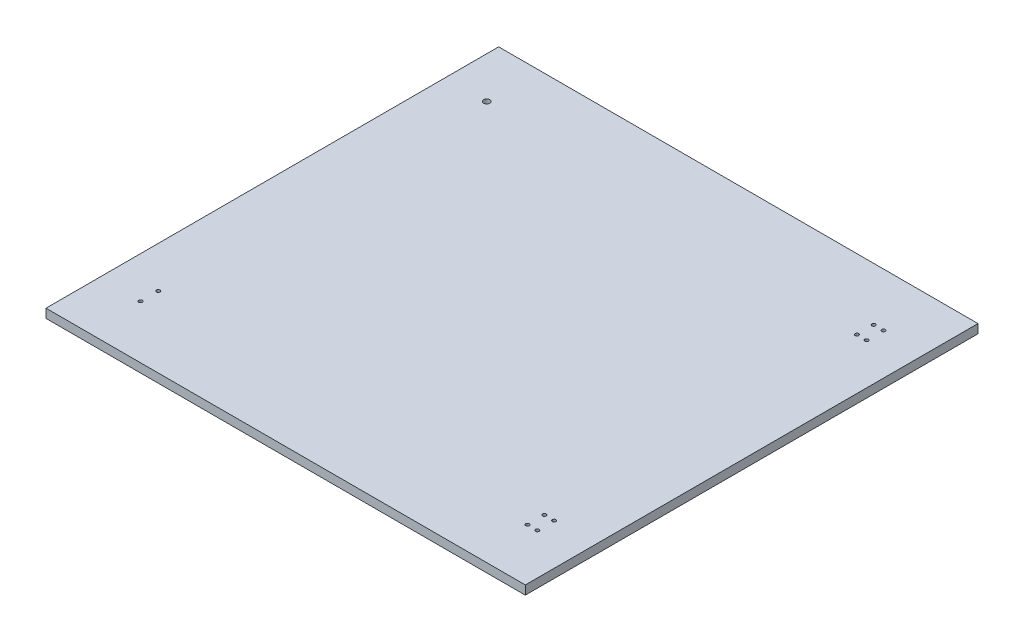
from build123d import *

# Parameters (mm, degrees)
SKETCH3_W           = 540
SKETCH3_H           = 510
BOSS_EXTRUDE1_DEPTH = 10
SKETCH4_R           = 2
CUT_EXTRUDE1_DEPTH  = 686.449855216
SKETCH6_R           = 2
CUT_EXTRUDE2_DEPTH  = 686.449855216
SKETCH7_R           = 3.5
CUT_EXTRUDE3_DEPTH  = 686.449855216
SKETCH8_R           = 2
CUT_EXTRUDE4_DEPTH  = 686.449855216


with BuildPart() as part:
    # Sketch3 → Boss-Extrude1 (new body)
    with BuildSketch(Plane(origin=(0, 0, 0), x_dir=(1, 0, 0), z_dir=(0, 1, 0))):
        with Locations((217.56999237, -226.681436799)):
            Rectangle(SKETCH3_W, SKETCH3_H)
    extrude(amount=BOSS_EXTRUDE1_DEPTH)

    # Sketch4 → Cut-Extrude1 (cut, through all)
    with BuildSketch(Plane(origin=(0, 10, 0), x_dir=(1, 0, 0), z_dir=(0, 1, 0))):
        with Locations((441.06999237, -31.681436799)):
            Circle(SKETCH4_R)
        with Locations((430.06999237, -31.681436799)):
            Circle(SKETCH4_R)
        with Locations((441.06999237, -50.681436799)):
            Circle(SKETCH4_R)
        with Locations((430.06999237, -50.681436799)):
            Circle(SKETCH4_R)
    extrude(amount=-CUT_EXTRUDE1_DEPTH, mode=Mode.SUBTRACT)

    # Sketch6 → Cut-Extrude2 (cut, through all)
    with BuildSketch(Plane.XZ):
        with Locations((441.06999237, 421.681436799)):
            Circle(SKETCH6_R)
        with Locations((430.06999237, 421.681436799)):
            Circle(SKETCH6_R)
        with Locations((441.06999237, 402.681436799)):
            Circle(SKETCH6_R)
        with Locations((430.06999237, 402.681436799)):
            Circle(SKETCH6_R)
    extrude(amount=-CUT_EXTRUDE2_DEPTH, mode=Mode.SUBTRACT)

    # Sketch7 → Cut-Extrude3 (cut, through all)
    with BuildSketch(Plane.XZ):
        with Locations((-5.93000763, 31.681436799)):
            Circle(SKETCH7_R)
    extrude(amount=-CUT_EXTRUDE3_DEPTH, mode=Mode.SUBTRACT)

    # Sketch8 → Cut-Extrude4 (cut, through all)
    with BuildSketch(Plane.XZ):
        with Locations((-5.93000763, 421.681436799)):
            Circle(SKETCH8_R)
        with Locations((-5.93000763, 401.681436799)):
            Circle(SKETCH8_R)
    extrude(amount=-CUT_EXTRUDE4_DEPTH, mode=Mode.SUBTRACT)


solid = part.part
